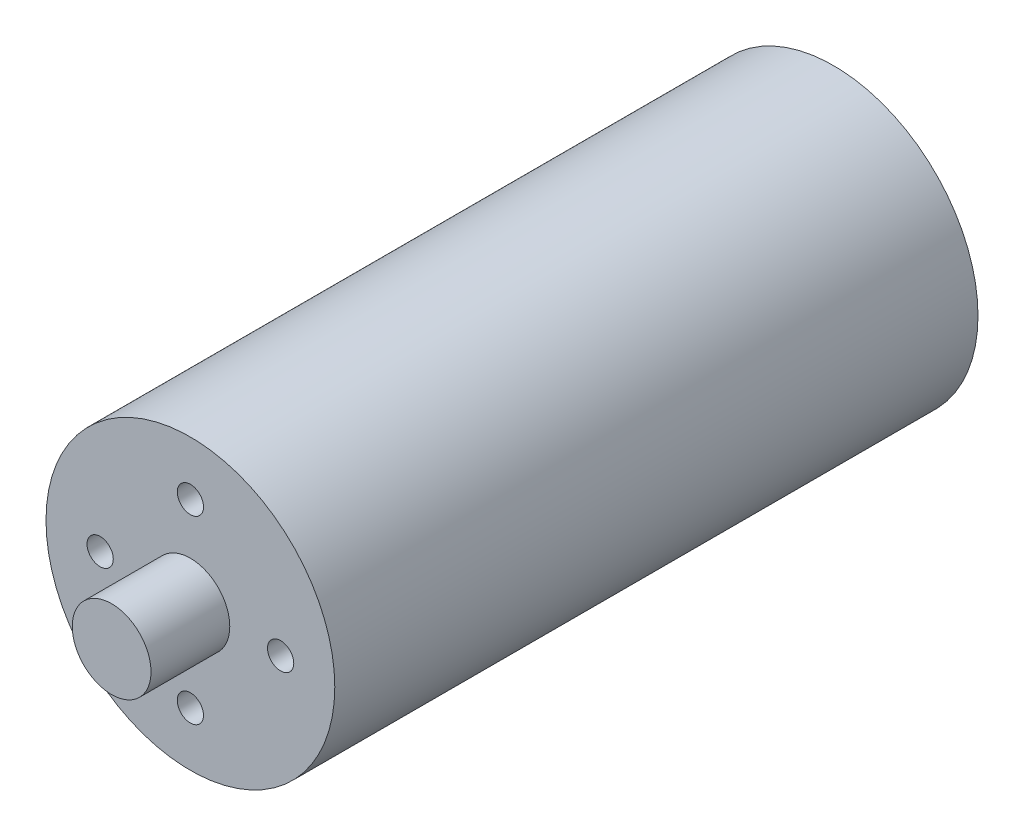
from build123d import *

# Parameters (mm, degrees)
SKETCH1_R           = 11
BOSS_EXTRUDE1_DEPTH = 49
SKETCH2_R           = 1
CUT_EXTRUDE1_DEPTH  = 3
SKETCH3_R           = 3
BOSS_EXTRUDE2_DEPTH = 6


with BuildPart() as part:
    # Sketch1 → Boss-Extrude1 (new body)
    with BuildSketch(Plane.XY):
        Circle(SKETCH1_R)
    extrude(amount=BOSS_EXTRUDE1_DEPTH)

    # Sketch2 → Cut-Extrude1 (cut)
    with BuildSketch(Plane.XY.offset(49)):
        with Locations((6.875, 0)):
            Circle(SKETCH2_R)
        with Locations((0, -6.875)):
            Circle(SKETCH2_R)
        with Locations((-6.875, 0)):
            Circle(SKETCH2_R)
        with Locations((0, 6.875)):
            Circle(SKETCH2_R)
    extrude(amount=-CUT_EXTRUDE1_DEPTH, mode=Mode.SUBTRACT)

    # Sketch3 → Boss-Extrude2 (add)
    with BuildSketch(Plane.XY.offset(49)):
        Circle(SKETCH3_R)
    extrude(amount=BOSS_EXTRUDE2_DEPTH)


solid = part.part
